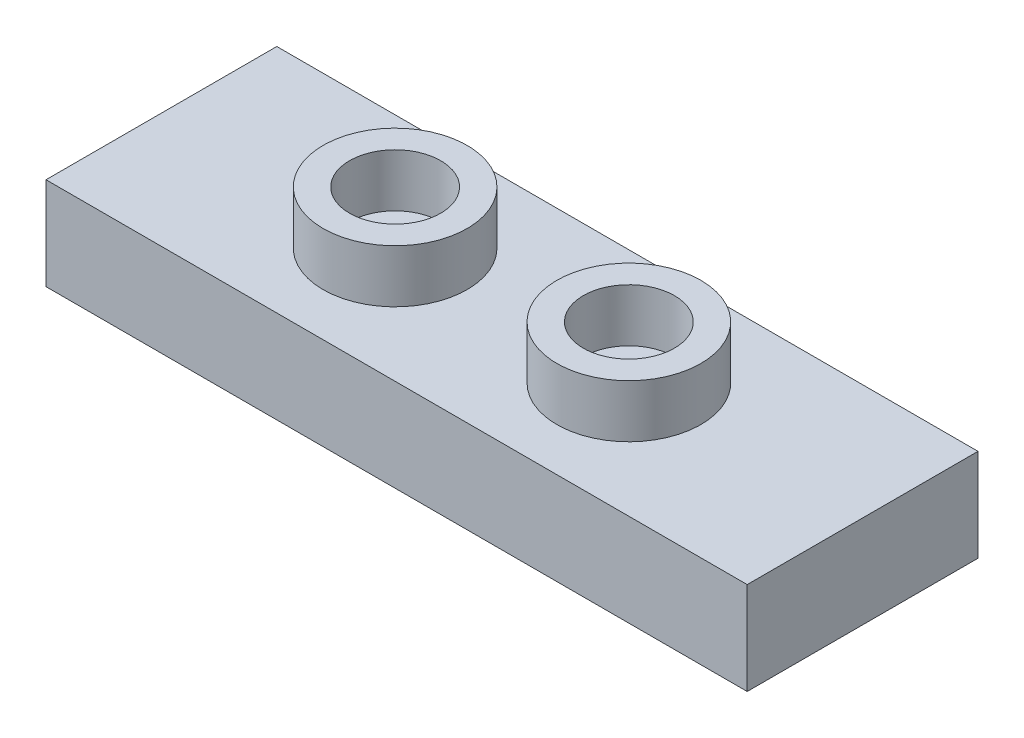
from build123d import *

# Parameters (mm, degrees)
SKETCH1_W           = 23.85
SKETCH1_H           = 7.85
BOSS_EXTRUDE1_DEPTH = 3.15
SHELL1_T            = -1.5
SKETCH2_R           = 2.45
SKETCH2_R_2         = 1.55
BOSS_EXTRUDE2_DEPTH = 1.8


with BuildPart() as part:
    # Sketch1 → Boss-Extrude1 (new body)
    with BuildSketch(Plane(origin=(0, 0, 0), x_dir=(1, 0, 0), z_dir=(0, 1, 0))):
        Rectangle(SKETCH1_W, SKETCH1_H)
    extrude(amount=-BOSS_EXTRUDE1_DEPTH)

    # Shell1
    shell1_openings = [part.faces().sort_by_distance(p)[0] for p in [
        (0, -3.15, 0),
    ]]
    offset(amount=SHELL1_T, openings=shell1_openings, kind=Kind.INTERSECTION)

    # Sketch2 → Boss-Extrude2 (add)
    # profile 1 of 2: a face of its own
    with BuildSketch(Plane(origin=(0, 0, 0), x_dir=(1, 0, 0), z_dir=(0, 1, 0))):
        with Locations(Location((-3.975, 0, 0), (0, 0, 270))):
            Circle(SKETCH2_R)
        with Locations(Location((-3.975, 0, 0), (0, 0, 270))):
            Circle(SKETCH2_R_2, mode=Mode.SUBTRACT)
    # profile 2 of 2: a face of its own
    with BuildSketch(Plane(origin=(0, 0, 0), x_dir=(1, 0, 0), z_dir=(0, 1, 0))):
        with Locations(Location((3.975, 0, 0), (0, 0, 90))):
            Circle(SKETCH2_R)
        with Locations(Location((3.975, 0, 0), (0, 0, 90))):
            Circle(SKETCH2_R_2, mode=Mode.SUBTRACT)
    extrude(amount=BOSS_EXTRUDE2_DEPTH)


solid = part.part
